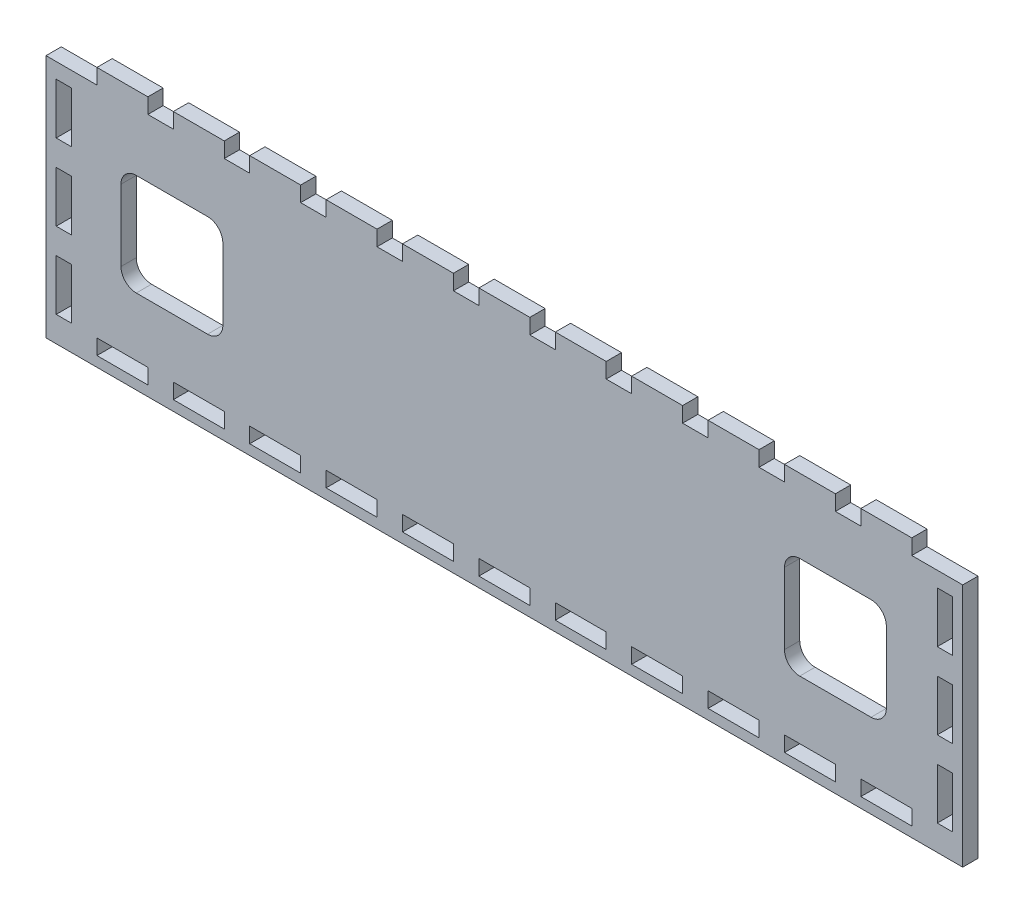
from build123d import *

# Parameters (mm, degrees)
SKETCH_1_W          = 3
SKETCH_1_H          = 10
SKETCH_1_W_2        = 10
SKETCH_1_H_2        = 3
EXTRUDE_1_DEPTH     = 3
SKETCH_2_W          = 20
SKETCH_2_H          = 20
CUT_EXTRUDE_1_DEPTH = 10
FILLET_1_R          = 3


with BuildPart() as part:
    # 草图1 → 凸台-拉伸1 (new body)
    with BuildSketch(Plane.XY):
        Polygon((-89.861316177, 22.916051468), (-79.861316177, 22.916051468), (-79.861316177, 25.916051468), (-69.861316177, 25.916051468), (-69.861316177, 22.916051468), (-64.861316177, 22.916051468), (-64.861316177, 25.916051468), (-54.861316177, 25.916051468), (-54.861316177, 22.916051468), (-49.861316177, 22.916051468), (-49.861316177, 25.916051468), (-39.861316177, 25.916051468), (-39.861316177, 22.916051468), (-34.861316177, 22.916051468), (-34.861316177, 25.916051468), (-24.861316177, 25.916051468), (-24.861316177, 22.916051468), (-19.861316177, 22.916051468), (-19.861316177, 25.916051468), (-9.861316177, 25.916051468), (-9.861316177, 22.916051468), (-4.861316177, 22.916051468), (-4.861316177, 25.916051468), (5.138683823, 25.916051468), (5.138683823, 22.916051468), (10.138683823, 22.916051468), (10.138683823, 25.916051468), (20.138683823, 25.916051468), (20.138683823, 22.916051468), (25.138683823, 22.916051468), (25.138683823, 25.916051468), (35.138683823, 25.916051468), (35.138683823, 22.916051468), (40.138683823, 22.916051468), (40.138683823, 25.916051468), (50.138683823, 25.916051468), (50.138683823, 22.916051468), (55.138683823, 22.916051468), (55.138683823, 25.916051468), (65.138683823, 25.916051468), (65.138683823, 22.916051468), (70.138683823, 22.916051468), (70.138683823, 25.916051468), (80.138683823, 25.916051468), (80.138683823, 22.916051468), (90.138683823, 22.916051468), (90.138683823, -25.083948532), (-89.861316177, -25.083948532), align=None)
        with Locations((-86.361316177, -0.083948532)):
            Rectangle(SKETCH_1_W, SKETCH_1_H, mode=Mode.SUBTRACT)
        with Locations((-86.361316177, 14.916051468)):
            Rectangle(SKETCH_1_W, SKETCH_1_H, mode=Mode.SUBTRACT)
        with Locations((-86.361316177, -15.083948532)):
            Rectangle(SKETCH_1_W, SKETCH_1_H, mode=Mode.SUBTRACT)
        with Locations((86.638683823, -15.083948532)):
            Rectangle(SKETCH_1_W, SKETCH_1_H, mode=Mode.SUBTRACT)
        with Locations((86.638683823, -0.083948532)):
            Rectangle(SKETCH_1_W, SKETCH_1_H, mode=Mode.SUBTRACT)
        with Locations((86.638683823, 14.916051468)):
            Rectangle(SKETCH_1_W, SKETCH_1_H, mode=Mode.SUBTRACT)
        with Locations((-59.861316177, -21.583948532)):
            Rectangle(SKETCH_1_W_2, SKETCH_1_H_2, mode=Mode.SUBTRACT)
        with Locations((-74.861316177, -21.583948532)):
            Rectangle(SKETCH_1_W_2, SKETCH_1_H_2, mode=Mode.SUBTRACT)
        with Locations((-44.861316177, -21.583948532)):
            Rectangle(SKETCH_1_W_2, SKETCH_1_H_2, mode=Mode.SUBTRACT)
        with Locations((-29.861316177, -21.583948532)):
            Rectangle(SKETCH_1_W_2, SKETCH_1_H_2, mode=Mode.SUBTRACT)
        with Locations((-14.861316177, -21.583948532)):
            Rectangle(SKETCH_1_W_2, SKETCH_1_H_2, mode=Mode.SUBTRACT)
        with Locations((0.138683823, -21.583948532)):
            Rectangle(SKETCH_1_W_2, SKETCH_1_H_2, mode=Mode.SUBTRACT)
        with Locations((15.138683823, -21.583948532)):
            Rectangle(SKETCH_1_W_2, SKETCH_1_H_2, mode=Mode.SUBTRACT)
        with Locations((30.138683823, -21.583948532)):
            Rectangle(SKETCH_1_W_2, SKETCH_1_H_2, mode=Mode.SUBTRACT)
        with Locations((45.138683823, -21.583948532)):
            Rectangle(SKETCH_1_W_2, SKETCH_1_H_2, mode=Mode.SUBTRACT)
        with Locations((60.138683823, -21.583948532)):
            Rectangle(SKETCH_1_W_2, SKETCH_1_H_2, mode=Mode.SUBTRACT)
        with Locations((75.138683823, -21.583948532)):
            Rectangle(SKETCH_1_W_2, SKETCH_1_H_2, mode=Mode.SUBTRACT)
    extrude(amount=EXTRUDE_1_DEPTH)

    # 草图2 → 切除-拉伸1 (cut)
    with BuildSketch(Plane.XY.offset(3)):
        with Locations((65.138683823, 1.413515523)):
            Rectangle(SKETCH_2_W, SKETCH_2_H)
        with Locations((-65.138683823, 1.413515523)):
            Rectangle(SKETCH_2_W, SKETCH_2_H)
    extrude(amount=-CUT_EXTRUDE_1_DEPTH, mode=Mode.SUBTRACT)

    # 圆角1
    fillet_1_edges = [part.edges().sort_by_distance(p)[0] for p in [
        (75.138683823, 11.413515523, 1.5),
        (75.138683823, -8.586484477, 1.5),
        (55.138683823, -8.586484477, 1.5),
        (55.138683823, 11.413515523, 1.5),
        (-55.138683823, 11.413515523, 1.5),
        (-55.138683823, -8.586484477, 1.5),
        (-75.138683823, -8.586484477, 1.5),
        (-75.138683823, 11.413515523, 1.5),
    ]]
    fillet(fillet_1_edges, radius=FILLET_1_R)


solid = part.part
